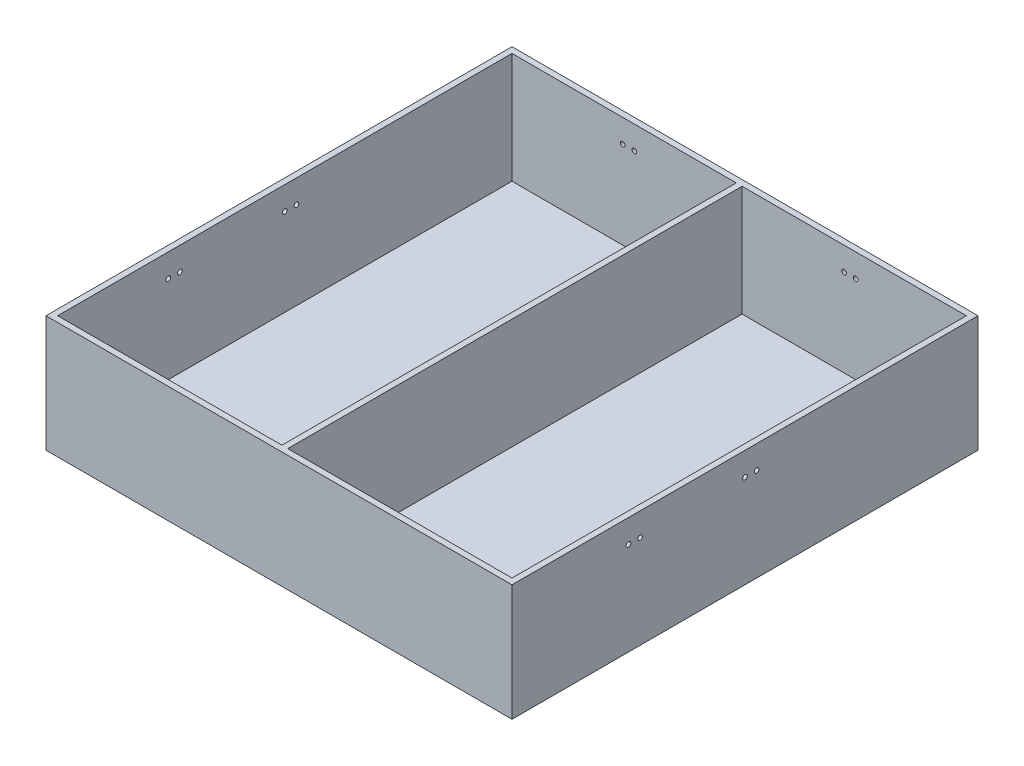
from build123d import *

# Parameters (mm, degrees)
SKETCH_1_W          = 800
SKETCH_1_H          = 800
SKETCH_1_W_2        = 385
SKETCH_1_H_2        = 780
EXTRUDE_1_DEPTH     = 200
SKETCH_2_W          = 800
SKETCH_2_H          = 800
EXTRUDE_2_DEPTH     = 10
EXTRUDE_3_DEPTH     = 10
EXTRUDE_3_2_DEPTH   = 10
SKETCH_4_R          = 4
CUT_EXTRUDE_1_DEPTH = 10
SKETCH_5_R          = 4
CUT_EXTRUDE_2_DEPTH = 10
EXTRUDE_4_DEPTH     = 10
CUT_EXTRUDE_3_REACH = 1087.28
SKETCH_7_R          = 4
CUT_EXTRUDE_4_REACH = 1156.96
SKETCH_8_R          = 4
SKETCH_9_W          = 2800
SKETCH_9_H          = 2800
SKETCH_9_W_2        = 800
SKETCH_9_H_2        = 800
CUT_EXTRUDE_5_DEPTH = 1157.647305275


with BuildPart() as part:
    # 草图1 → 凸台-拉伸1 (new body)
    with BuildSketch(Plane(origin=(0, 0, 0), x_dir=(1, 0, 0), z_dir=(0, 1, 0))):
        Rectangle(SKETCH_1_W, SKETCH_1_H)
        with Locations((-197.5, 0)):
            Rectangle(SKETCH_1_W_2, SKETCH_1_H_2, mode=Mode.SUBTRACT)
        with Locations((197.5, 0)):
            Rectangle(SKETCH_1_W_2, SKETCH_1_H_2, mode=Mode.SUBTRACT)
    extrude(amount=EXTRUDE_1_DEPTH)

    # 草图2 → 凸台-拉伸2 (add)
    with BuildSketch(Plane.XZ):
        Rectangle(SKETCH_2_W, SKETCH_2_H)
    extrude(amount=-EXTRUDE_2_DEPTH)

    # 草图4 → 切除-拉伸1 (cut)
    with BuildSketch(Plane.ZY.offset(400)):
        with Locations((180, 160)):
            Circle(SKETCH_4_R)
        with Locations((200, 160)):
            Circle(SKETCH_4_R)
        with Locations((-20, 160)):
            Circle(SKETCH_4_R)
        with Locations((0, 160)):
            Circle(SKETCH_4_R)
    cut_extrude_1 = extrude(amount=-CUT_EXTRUDE_1_DEPTH, mode=Mode.SUBTRACT)


with BuildPart() as body_2:
    # 草图3 → 凸台-拉伸3 (new body)
    with BuildSketch(Plane(origin=(0, 200, 0), x_dir=(1, 0, 0), z_dir=(0, 1, 0))):
        with BuildLine():
            Line((-400, 400), (-400, -400))
            Line((-400, -400), (-552.7864045, -400))
            ThreePointArc((-552.7864045, -400), (-682.754282993, -327.538161854), (-689.4427191, -178.8854382))
            Line((-689.4427191, -178.8854382), (-400, 400))
        make_face()
    extrude(amount=-EXTRUDE_3_DEPTH)

    # 草图5 → 切除-拉伸2 (cut)
    with BuildSketch(Plane(origin=(0, 200, 0), x_dir=(1, 0, 0), z_dir=(0, 1, 0))):
        with Locations(Location((-430, -180, 0), (0, 0, 270))):
            Circle(SKETCH_5_R)
        with Locations(Location((-430, -200, 0), (0, 0, 270))):
            Circle(SKETCH_5_R)
        with Locations(Location((-430, 20, 0), (0, 0, 270))):
            Circle(SKETCH_5_R)
        with Locations(Location((-430, 0, 0), (0, 0, 270))):
            Circle(SKETCH_5_R)
    cut_extrude_2 = extrude(amount=-CUT_EXTRUDE_2_DEPTH, mode=Mode.SUBTRACT)


with BuildPart() as body_3:
    # 草图3 → Extrude 3 2 (new body)
    with BuildSketch(Plane(origin=(0, 200, 0), x_dir=(1, 0, 0), z_dir=(0, 1, 0))):
        with BuildLine():
            Line((689.4427191, -178.8854382), (400, 400))
            Line((400, 400), (400, -400))
            Line((400, -400), (552.7864045, -400))
            ThreePointArc((552.7864045, -400), (682.754282993, -327.538161854), (689.4427191, -178.8854382))
        make_face()
    extrude(amount=-EXTRUDE_3_2_DEPTH)


with BuildPart() as mirror_1_tool:
    # 镜向1: 切除-拉伸1, 切除-拉伸2 across plane
    add(cut_extrude_1.mirror(Plane(origin=(0, 0, 0), x_dir=(0, 0, 1), z_dir=(1, 0, 0))))
    add(cut_extrude_2.mirror(Plane(origin=(0, 0, 0), x_dir=(0, 0, 1), z_dir=(1, 0, 0))))


with BuildPart() as part_1:
    add(part.part)

    # 镜向1: cut by mirror_1_tool
    add(mirror_1_tool.part, mode=Mode.SUBTRACT)


    add(body_2.part)  # 凸台-拉伸4 merges body 2


with BuildPart() as body_3_1:
    add(body_3.part)

    # 镜向1: cut by mirror_1_tool
    add(mirror_1_tool.part, mode=Mode.SUBTRACT)


with BuildPart() as part_2:
    add(part_1.part)

    add(body_3_1.part)  # 凸台-拉伸4 merges body 3
    # 草图6 → 凸台-拉伸4 (add)
    with BuildSketch(Plane(origin=(0, 200, 0), x_dir=(1, 0, 0), z_dir=(0, 1, 0))):
        with BuildLine():
            Line((-400, 400), (-221.1145618, 757.7708764))
            ThreePointArc((-221.1145618, 757.7708764), (0, 894.427191), (221.1145618, 757.7708764))
            Line((221.1145618, 757.7708764), (400, 400))
            Line((400, 400), (-400, 400))
        make_face()
    extrude(amount=-EXTRUDE_4_DEPTH)

    # 草图7 → 切除-拉伸3 (cut, up to next)
    with BuildSketch(Plane(origin=(0, 0, -400), x_dir=(-1, 0, 0), z_dir=(0, 0, -1)), mode=Mode.PRIVATE) as cut_extrude_3_sk1:
        with Locations((-200, 160)):
            Circle(SKETCH_7_R)
    cut_extrude_3_tool1 = extrude(cut_extrude_3_sk1.sketch, amount=-CUT_EXTRUDE_3_REACH, mode=Mode.PRIVATE) & part_2.part
    # 草图7 → 切除-拉伸3 (cut, up to next)
    with BuildSketch(Plane(origin=(0, 0, -400), x_dir=(-1, 0, 0), z_dir=(0, 0, -1)), mode=Mode.PRIVATE) as cut_extrude_3_sk2:
        with Locations((-180, 160)):
            Circle(SKETCH_7_R)
    cut_extrude_3_tool2 = extrude(cut_extrude_3_sk2.sketch, amount=-CUT_EXTRUDE_3_REACH, mode=Mode.PRIVATE) & part_2.part
    cut_extrude_3_1 = cut_extrude_3_tool1.solids().sort_by_distance((200, 160, -400))[0]
    add(cut_extrude_3_1, mode=Mode.SUBTRACT)
    cut_extrude_3_2 = cut_extrude_3_tool2.solids().sort_by_distance((180, 160, -400))[0]
    add(cut_extrude_3_2, mode=Mode.SUBTRACT)
    cut_extrude_3 = cut_extrude_3_1 + cut_extrude_3_2  # 切除-拉伸3 as one shape, for the pattern or mirror that repeats it

    # 草图8 → 切除-拉伸4 (cut, up to next)
    with BuildSketch(Plane.XZ.offset(-190), mode=Mode.PRIVATE) as cut_extrude_4_sk1:
        with Locations(Location((180, -430, 0), (0, 0, 270))):
            Circle(SKETCH_8_R)
    cut_extrude_4_tool1 = extrude(cut_extrude_4_sk1.sketch, amount=-CUT_EXTRUDE_4_REACH, mode=Mode.PRIVATE) & part_2.part
    # 草图8 → 切除-拉伸4 (cut, up to next)
    with BuildSketch(Plane.XZ.offset(-190), mode=Mode.PRIVATE) as cut_extrude_4_sk2:
        with Locations(Location((200, -430, 0), (0, 0, 270))):
            Circle(SKETCH_8_R)
    cut_extrude_4_tool2 = extrude(cut_extrude_4_sk2.sketch, amount=-CUT_EXTRUDE_4_REACH, mode=Mode.PRIVATE) & part_2.part
    cut_extrude_4_1 = cut_extrude_4_tool1.solids().sort_by_distance((180, 190, -430))[0]
    add(cut_extrude_4_1, mode=Mode.SUBTRACT)
    cut_extrude_4_2 = cut_extrude_4_tool2.solids().sort_by_distance((200, 190, -430))[0]
    add(cut_extrude_4_2, mode=Mode.SUBTRACT)
    cut_extrude_4 = cut_extrude_4_1 + cut_extrude_4_2  # 切除-拉伸4 as one shape, for the pattern or mirror that repeats it

    # 镜向2: 切除-拉伸3, 切除-拉伸4 across plane
    add(cut_extrude_3.mirror(Plane(origin=(0, 0, 0), x_dir=(0, 0, 1), z_dir=(1, 0, 0))), mode=Mode.SUBTRACT)
    add(cut_extrude_4.mirror(Plane(origin=(0, 0, 0), x_dir=(0, 0, 1), z_dir=(1, 0, 0))), mode=Mode.SUBTRACT)

    # 草图9 → 切除-拉伸5 (cut, through all)
    with BuildSketch(Plane.XZ):
        Rectangle(SKETCH_9_W, SKETCH_9_H)
        Rectangle(SKETCH_9_W_2, SKETCH_9_H_2, mode=Mode.SUBTRACT)
    extrude(amount=-CUT_EXTRUDE_5_DEPTH, mode=Mode.SUBTRACT)


solid = part_2.part
